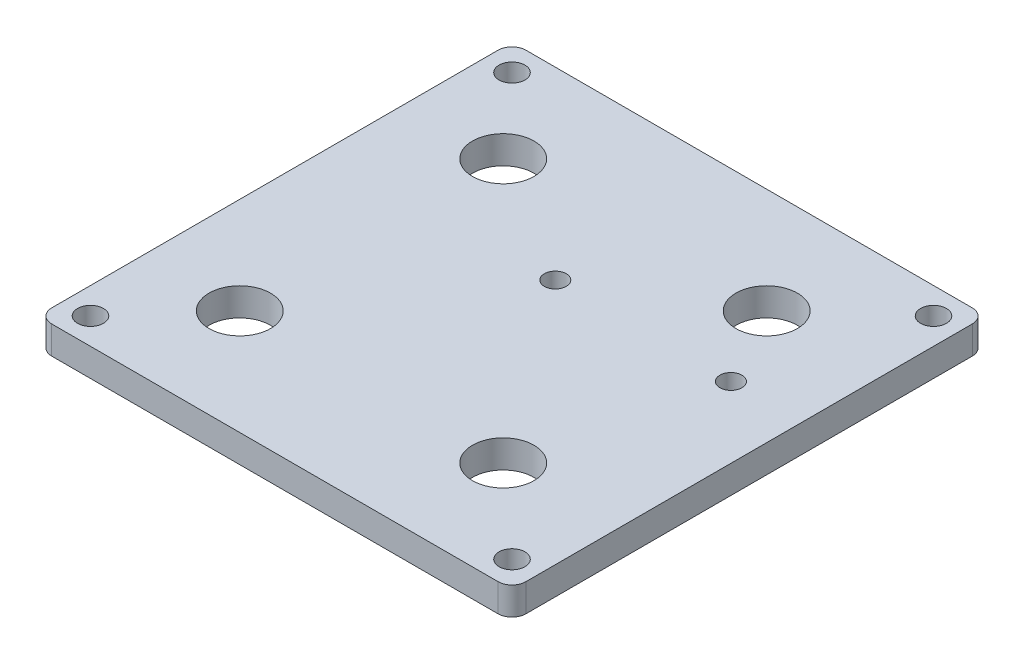
from build123d import *

# Parameters (mm, degrees)
SKETCH1_W             = 42
SKETCH1_H             = 44
SKETCH1_R             = 0.5
SKETCH1_R_2           = 3.5
SKETCH1_H_2           = 5
BOSS_EXTRUDE1_DEPTH   = 3.175
SKETCH3_W             = 6
SKETCH3_H             = 54
SKETCH3_R             = 1.4732
BOSS_EXTRUDE2_DEPTH   = 3.175
M3X0_5_TAPPED_HOLE1_D = 2.5
FILLET1_R             = 1.5875


with BuildPart() as part:
    # Sketch1 → Boss-Extrude1 (new body)
    # profile 1 of 3: a face of its own
    with BuildSketch(Plane(origin=(0, 0, 0), x_dir=(1, 0, 0), z_dir=(0, 1, 0))):
        with Locations((21, -22)):
            Rectangle(SKETCH1_W, SKETCH1_H)
        with Locations(Location((39.93, -16, 0), (0, 0, 270))):
            Circle(SKETCH1_R, mode=Mode.SUBTRACT)
        with Locations(Location((19.93, -16, 0), (0, 0, 270))):
            Circle(SKETCH1_R, mode=Mode.SUBTRACT)
        with Locations(Location((5, -37, 0), (0, 0, 270))):
            Circle(SKETCH1_R_2, mode=Mode.SUBTRACT)
        with Locations(Location((35, -37, 0), (0, 0, 270))):
            Circle(SKETCH1_R_2, mode=Mode.SUBTRACT)
        with Locations(Location((35, -7, 0), (0, 0, 270))):
            Circle(SKETCH1_R_2, mode=Mode.SUBTRACT)
        with Locations(Location((5, -7, 0), (0, 0, 270))):
            Circle(SKETCH1_R_2, mode=Mode.SUBTRACT)
    # profile 2 of 3: a face of its own
    with BuildSketch(Plane(origin=(0, 0, 0), x_dir=(1, 0, 0), z_dir=(0, 1, 0))):
        with Locations((21, 2.5)):
            Rectangle(SKETCH1_W, SKETCH1_H_2)
    # profile 3 of 3: a face of its own
    with BuildSketch(Plane(origin=(0, 0, 0), x_dir=(1, 0, 0), z_dir=(0, 1, 0))):
        with Locations((21, -46.5)):
            Rectangle(SKETCH1_W, SKETCH1_H_2)
    extrude(amount=BOSS_EXTRUDE1_DEPTH)

    # Sketch3 → Boss-Extrude2 (add)
    # profile 1 of 2: a face of its own
    with BuildSketch(Plane(origin=(0, 3.175, 0), x_dir=(1, 0, 0), z_dir=(0, 1, 0))):
        with Locations((-3, -22)):
            Rectangle(SKETCH3_W, SKETCH3_H)
        with Locations(Location((-3, 2, 0), (0, 0, 270))):
            Circle(SKETCH3_R, mode=Mode.SUBTRACT)
        with Locations(Location((-3, -46, 0), (0, 0, 270))):
            Circle(SKETCH3_R, mode=Mode.SUBTRACT)
    # profile 2 of 2: a face of its own
    with BuildSketch(Plane(origin=(0, 3.175, 0), x_dir=(1, 0, 0), z_dir=(0, 1, 0))):
        with Locations((45, -22)):
            Rectangle(SKETCH3_W, SKETCH3_H)
        with Locations(Location((45, -46, 0), (0, 0, 270))):
            Circle(SKETCH3_R, mode=Mode.SUBTRACT)
        with Locations(Location((45, 2, 0), (0, 0, 270))):
            Circle(SKETCH3_R, mode=Mode.SUBTRACT)
    extrude(amount=-BOSS_EXTRUDE2_DEPTH)

    # M3x0.5 Tapped Hole1 (through all)
    with Locations(Plane(origin=(39.93, 3.175, 16), x_dir=(0, 0, 1), z_dir=(0, 1, 0))):
        with Locations((0, 0), (0, -20)):
            Hole(M3X0_5_TAPPED_HOLE1_D / 2)

    # Fillet1
    fillet1_edges = [part.edges().sort_by_distance(p)[0] for p in [
        (-6, 1.5875, -5),
        (-6, 1.5875, 49),
        (48, 1.5875, 49),
        (48, 1.5875, -5),
    ]]
    fillet(fillet1_edges, radius=FILLET1_R)


solid = part.part
